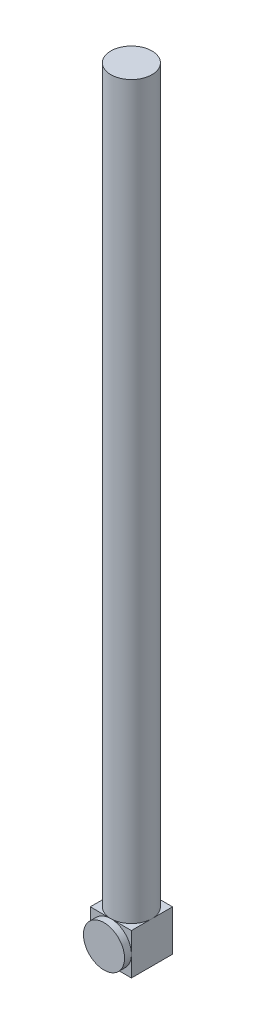
from build123d import *

# Parameters (mm, degrees)
SKETCH1_R           = 7.5
BOSS_EXTRUDE1_DEPTH = 266.7
BOSS_EXTRUDE2_START = 15
SKETCH2_R           = 7.5
BOSS_EXTRUDE2_DEPTH = 15
SKETCH3_R           = 7.5
BOSS_EXTRUDE3_DEPTH = 2.5


with BuildPart() as part:
    # Sketch1 → Boss-Extrude1 (new body)
    with BuildSketch(Plane(origin=(0, 0, 0), x_dir=(1, 0, 0), z_dir=(0, 1, 0))):
        with Locations(Location((0, 0, 0), (0, 0, 270))):
            Circle(SKETCH1_R)
    extrude(amount=BOSS_EXTRUDE1_DEPTH)

    # Sketch2 → Boss-Extrude2 (add)
    with BuildSketch(Plane.XZ.offset(BOSS_EXTRUDE2_START)):
        with BuildLine():
            Line((0, 7.5), (-7.5, 7.5))
            Line((-7.5, 7.5), (-7.5, 0))
            ThreePointArc((-7.5, 0), (-5.303300859, 5.303300859), (0, 7.5))
        make_face()
        with Locations(Location((0, 0, 0), (0, 0, 90))):
            Circle(SKETCH2_R)
        with BuildLine():
            Line((7.5, 7.5), (0, 7.5))
            ThreePointArc((0, 7.5), (5.303300859, 5.303300859), (7.5, 0))
            Line((7.5, 0), (7.5, 7.5))
        make_face()
        with BuildLine():
            Line((7.5, -7.5), (7.5, 0))
            ThreePointArc((7.5, 0), (5.303300859, -5.303300859), (0, -7.5))
            Line((0, -7.5), (7.5, -7.5))
        make_face()
        with BuildLine():
            ThreePointArc((0, -7.5), (-5.303300859, -5.303300859), (-7.5, 0))
            Line((-7.5, 0), (-7.5, -7.5))
            Line((-7.5, -7.5), (0, -7.5))
        make_face()
    extrude(amount=-BOSS_EXTRUDE2_DEPTH)

    # Sketch3 → Boss-Extrude3 (add)
    with BuildSketch(Plane.XY.offset(7.5)):
        with Locations((0, -7.5)):
            Circle(SKETCH3_R)
    extrude(amount=BOSS_EXTRUDE3_DEPTH)


solid = part.part
